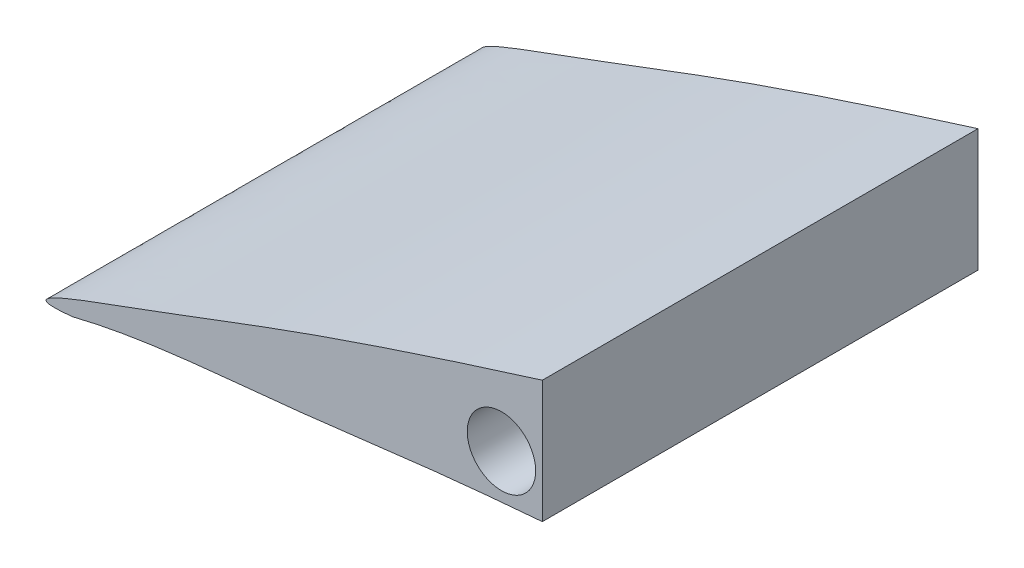
from build123d import *

# Parameters (mm, degrees)
SKETCH1_R           = 2.127
SKETCH1_R_2         = 2.032
BOSS_EXTRUDE1_DEPTH = 27.0764
SKETCH2_W           = 104.732489184
SKETCH2_H           = 32.948386637
CUT_EXTRUDE1_DEPTH  = 27.0764


with BuildPart() as part:
    # Sketch1 → Boss-Extrude1 (new body)
    with BuildSketch(Plane.XY):
        with BuildLine():
            Line((42.918297493, -0.447743106), (42.918297493, 8.263094686))
            ThreePointArc((42.918297493, 8.263094686), (40.994864427, 12.243356636), (36.681098599, 13.209536914))
            add(Edge.make_bspline(
                [(36.681098599, 13.209536914), (19.829765645, 9.267240013), (-2.073589943, 3.844068304), (-31.096466219, -5.545914493), (-39.316765165, -8.806631661), (-49.515556323, -12.495660485), (-45.77248955, -12.10685039)],
                knots=[0.118068853, 0.118068853, 0.118068853, 0.118068853, 0.630725311, 0.824213609, 0.940085477, 1, 1, 1, 1], degree=3))
            add(Edge.make_bspline(
                [(-45.77248955, -12.10685039), (-41.337443699, -10.999265489), (-33.831609628, -10.530043097), (-20.483498257, -8.707547198), (-8.873433654, -8.01917435), (11.524588595, -6.028171323), (26.067321973, -5.659784939), (37.895141959, -5.527425055)],
                knots=[0, 0, 0, 0, 0.144322392, 0.237947652, 0.42712275, 0.512831912, 0.887817721, 0.887817721, 0.887817721, 0.887817721], degree=3))
            ThreePointArc((37.895141959, -5.527425055), (41.450441586, -4.019691462), (42.918297493, -0.447743106))
        make_face()
        with Locations((-19.10248955, -6.01085039)):
            Circle(SKETCH1_R, mode=Mode.SUBTRACT)
        with Locations((12.64751045, 4.40314961)):
            Circle(SKETCH1_R, mode=Mode.SUBTRACT)
        with Locations((33.89346968, 3.421717851)):
            Circle(SKETCH1_R_2, mode=Mode.SUBTRACT)
    extrude(amount=BOSS_EXTRUDE1_DEPTH)

    # Sketch2 → Cut-Extrude1 (cut)
    with BuildSketch(Plane.XY.offset(27.0764)):
        with Locations((35.803755042, -2.355433399)):
            Rectangle(SKETCH2_W, SKETCH2_H)
    extrude(amount=-CUT_EXTRUDE1_DEPTH, mode=Mode.SUBTRACT)


solid = part.part
